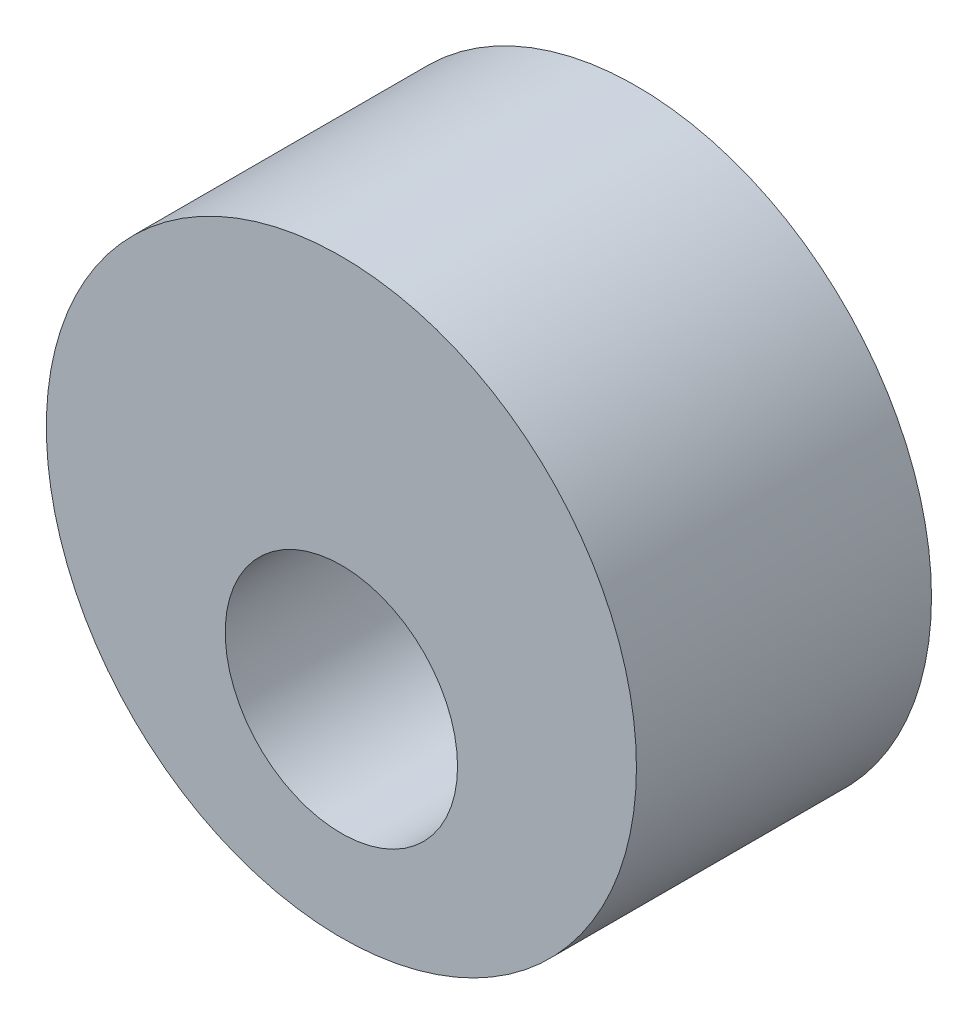
from build123d import *

# Parameters (mm, degrees)
SKETCH1_R           = 6.35
SKETCH1_R_2         = 2.499995
BOSS_EXTRUDE1_DEPTH = 6.35


with BuildPart() as part:
    # Sketch1 → Boss-Extrude1 (new body)
    with BuildSketch(Plane.XY):
        Circle(SKETCH1_R)
        with Locations((0, -1.905)):
            Circle(SKETCH1_R_2, mode=Mode.SUBTRACT)
    extrude(amount=BOSS_EXTRUDE1_DEPTH)


solid = part.part
